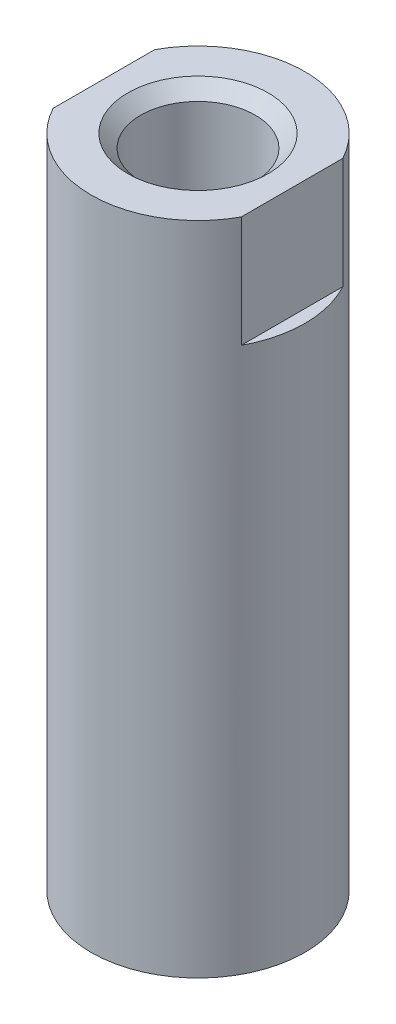
from build123d import *

# Parameters (mm, degrees)
SKETCH1_W                = 3.175
SKETCH1_H                = 19.4818
CUT_EXTRUDE1_START       = -3.302
CUT_EXTRUDE1_DEPTH       = 3.302
CUT_EXTRUDE2_START       = -3.302
CUT_EXTRUDE2_DEPTH       = 3.302
M3_CLEARANCE_HOLE1_D     = 3.40106
M3_CLEARANCE_HOLE1_DEPTH = 11.684
CHAMFER1_SIZE            = 0.38227


with BuildPart() as part:
    # Sketch1 → Revolve1 (revolve)
    with BuildSketch(Plane(origin=(0, 0, 0), x_dir=(-1, 0, 0), z_dir=(0, 0, -1)), mode=Mode.PRIVATE) as revolve1_sk:
        with Locations((-1.5875, 9.7409)):
            Rectangle(SKETCH1_W, SKETCH1_H)
    revolve(revolve1_sk.sketch.rotate(Axis((0, 0, 0), (0, 1, 0)), 270), axis=Axis((0, 0, 0), (0, 1, 0)))

    # Sketch2 → Cut-Extrude1 (cut)
    with BuildSketch(Plane(origin=(0, 19.4818, 0), x_dir=(-1, 0, 0), z_dir=(0, 1, 0)).offset(CUT_EXTRUDE1_START)):
        with BuildLine():
            Line((2.794, 1.508041445), (2.794, -1.508041445))
            ThreePointArc((2.794, -1.508041445), (3.175, 0), (2.794, 1.508041445))
        make_face()
    extrude(amount=CUT_EXTRUDE1_DEPTH, mode=Mode.SUBTRACT)

    # Sketch3 → Cut-Extrude2 (cut)
    with BuildSketch(Plane(origin=(0, 19.4818, 0), x_dir=(-1, 0, 0), z_dir=(0, 1, 0)).offset(CUT_EXTRUDE2_START)):
        with BuildLine():
            Line((-2.794, -1.508041445), (-2.794, 1.508041445))
            ThreePointArc((-2.794, 1.508041445), (-3.175, 0), (-2.794, -1.508041445))
        make_face()
    extrude(amount=CUT_EXTRUDE2_DEPTH, mode=Mode.SUBTRACT)

    # M3 Clearance Hole1
    with Locations(Plane(origin=(0, 19.4818, 0), x_dir=(1, 0, 0), z_dir=(0, 1, 0))):
        with Locations((0, 0)):
            Hole(M3_CLEARANCE_HOLE1_D / 2, depth=M3_CLEARANCE_HOLE1_DEPTH)

    # Chamfer1
    chamfer1_edges = [part.edges().sort_by_distance(p)[0] for p in [
        (1.70053, 19.4818, 0),
    ]]
    chamfer(chamfer1_edges, length=CHAMFER1_SIZE)


solid = part.part
